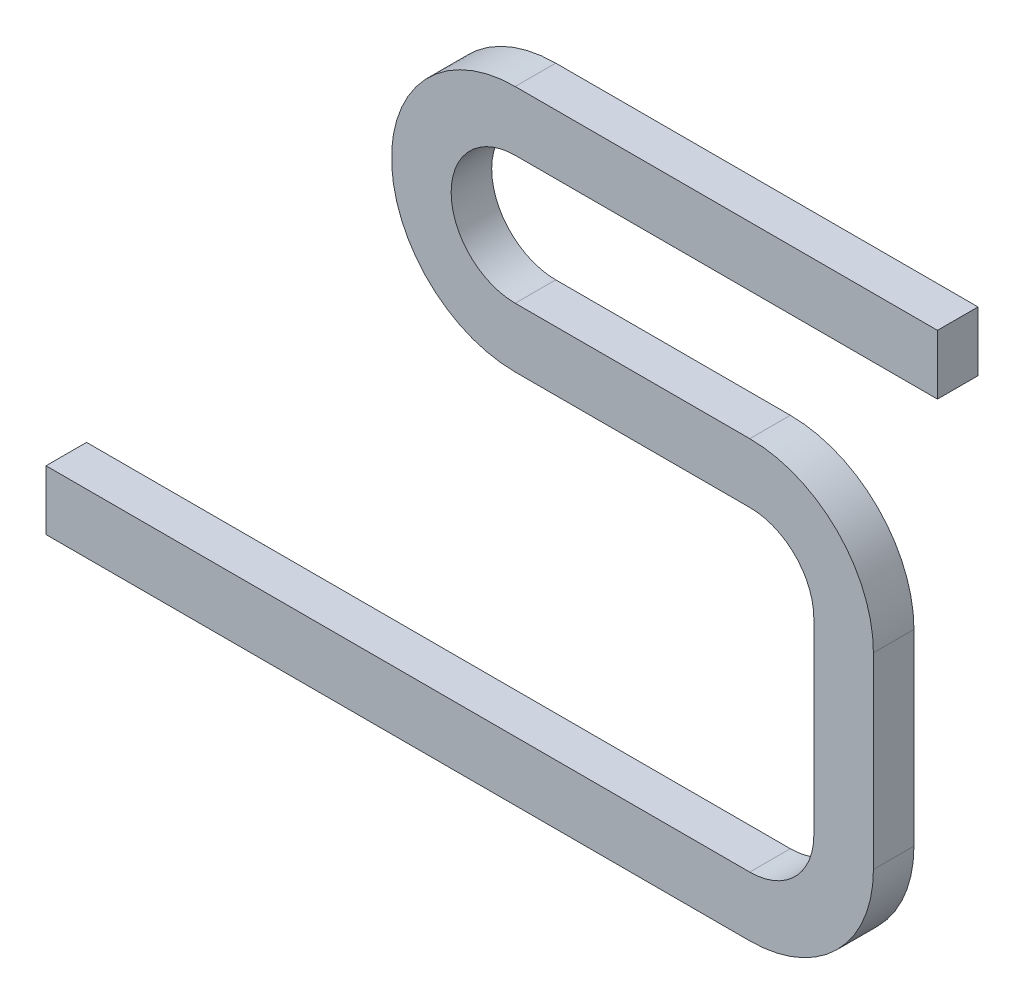
from build123d import *

# Parameters (mm, degrees)
SKETCH2_W = 0.432
SKETCH2_H = 0.635


with BuildPart() as part:
    # Sweep1: sweep along a path in Sketch1
    with BuildLine(Plane.XY) as sweep1_path:
        Line((0, 0), (7.5, 0))
        ThreePointArc((7.5, 0), (8.207106781, 0.292893219), (8.5, 1))
        Line((8.5, 1), (8.5, 3))
        ThreePointArc((8.5, 3), (8.207106781, 3.707106781), (7.5, 4))
        Line((7.5, 4), (5, 4))
        ThreePointArc((5, 4), (4, 5), (5, 6))
        Line((5, 6), (9.5, 6))
    # Sketch2 → Sweep1 (sweep)
    with BuildSketch(Plane(origin=(0, 0, 0), x_dir=(0, 0, -1), z_dir=(1, 0, 0))):
        Rectangle(SKETCH2_W, SKETCH2_H)
    sweep(path=sweep1_path.line)


solid = part.part
